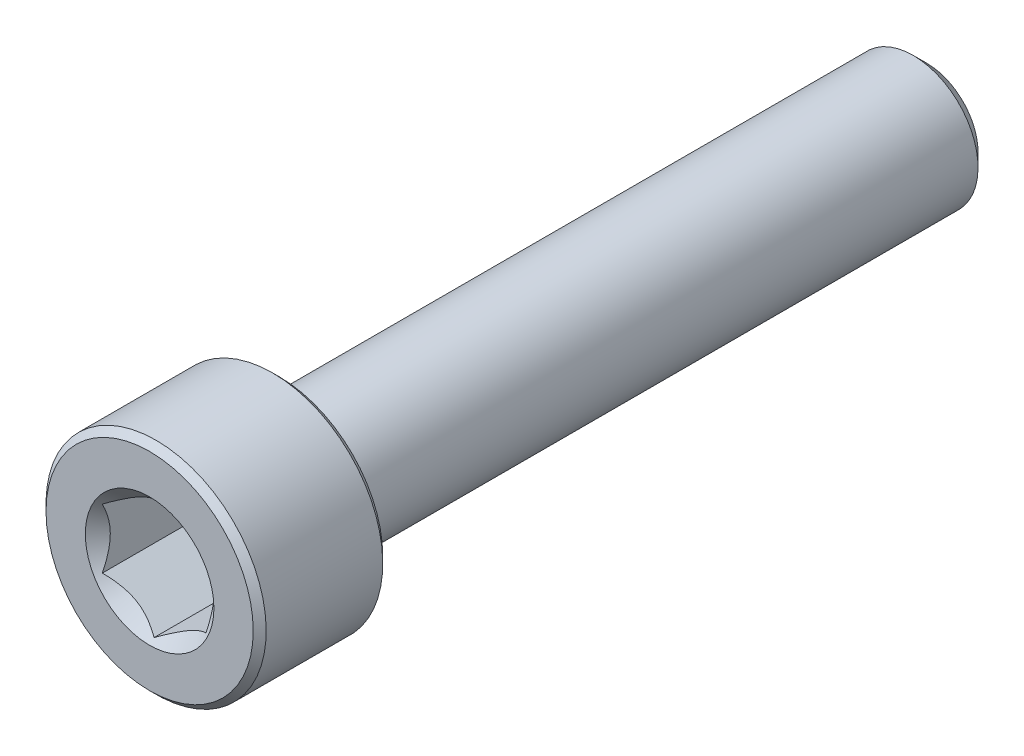
from build123d import *

# Parameters (mm, degrees)
CUT_EXTRUDE1_DEPTH = 4


with BuildPart() as part:
    # Sketch2 → Revolve1 (revolve)
    with BuildSketch(Plane(origin=(0, 0, 0), x_dir=(0, 0, -1), z_dir=(1, 0, 0))):
        with BuildLine():
            Line((-15, 0), (-15, 4))
            Line((-15, 4), (-14.75, 4.25))
            Line((-14.75, 4.25), (-10.25, 4.25))
            Line((-10.25, 4.25), (-10, 4))
            Line((-10, 4), (-10, 2.75))
            ThreePointArc((-10, 2.75), (-9.926776695, 2.573223305), (-9.75, 2.5))
            Line((-9.75, 2.5), (14.480384758, 2.5))
            Line((14.480384758, 2.5), (15, 1.980384758))
            Line((15, 1.980384758), (15, 0))
            Line((15, 0), (-15, 0))
        make_face()
    revolve(axis=Axis((0, 0, -15), (0, 0, 1)))

    # Sketch3 → Cut-Extrude1 (cut)
    with BuildSketch(Plane.XY.offset(15)):
        Polygon((2, -1.154700538), (2, 1.154700538), (0, 2.309401077), (-2, 1.154700538), (-2, -1.154700538), (0, -2.309401077), align=None)
    extrude(amount=-CUT_EXTRUDE1_DEPTH, mode=Mode.SUBTRACT)

    # Cut-Extrude2 cone 1 section (through the dimple's axis) → Cut-Extrude2 (revolve, cut)
    with BuildSketch(Plane(origin=(0, 0, 15), x_dir=(0, -1, 0), z_dir=(1, 0, 0))):
        Polygon((0, 0), (2.482606158, 0), (0, 2.482606158), align=None)
    revolve(axis=Axis((0, 0, 15), (0, 0, -1)), mode=Mode.SUBTRACT)


solid = part.part
